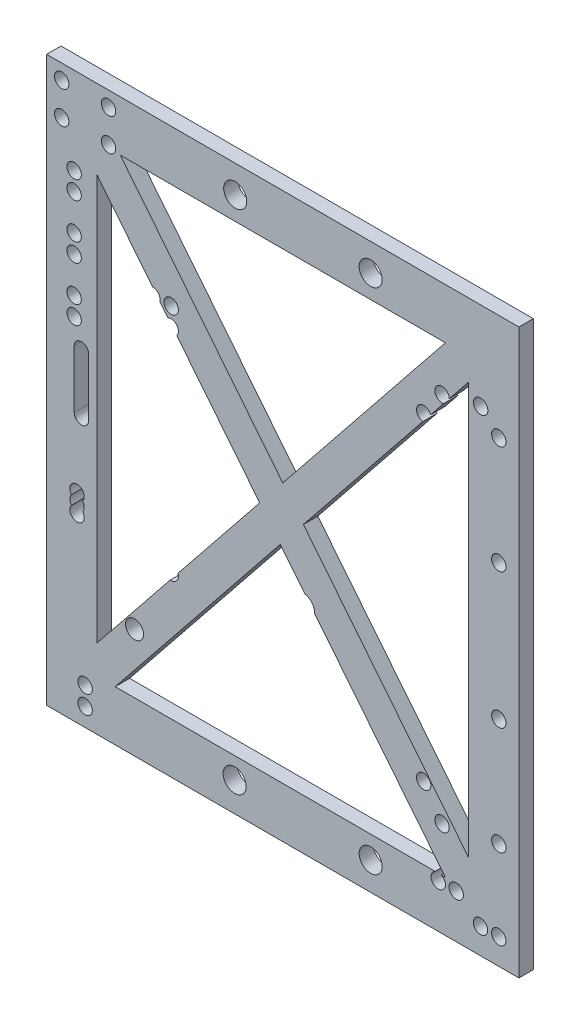
from build123d import *

# Parameters (mm, degrees)
SKETCH3_W            = 65.532
SKETCH3_H            = 78.232
SKETCH3_R            = 1
SKETCH3_R_2          = 1.25
SKETCH3_R_3          = 1.6
BOSS_EXTRUDE10_DEPTH = 2


with BuildPart() as part:
    # Sketch3 → Boss-Extrude10 (new body)
    with BuildSketch(Plane.XY):
        with Locations((-32.766, 39.116)):
            Rectangle(SKETCH3_W, SKETCH3_H)
        with Locations((-60.198, 2.535)):
            Circle(SKETCH3_R, mode=Mode.SUBTRACT)
        with Locations((-60.198, 5.075)):
            Circle(SKETCH3_R, mode=Mode.SUBTRACT)
        with Locations((-53.34, 15.24)):
            Circle(SKETCH3_R_2, mode=Mode.SUBTRACT)
        with Locations((-39.450944, 4.064)):
            Circle(SKETCH3_R_3, mode=Mode.SUBTRACT)
        with BuildLine():
            ThreePointArc((-60.547487864, 25.781), (-60.378588258, 25.483259443), (-60.32, 25.146))
            ThreePointArc((-60.32, 25.146), (-61.657259443, 24.204588258), (-62.092512136, 25.781))
            ThreePointArc((-62.092512136, 25.781), (-62.32, 26.416), (-62.092512136, 27.051))
            ThreePointArc((-62.092512136, 27.051), (-61.657259443, 28.627411742), (-60.32, 27.686))
            ThreePointArc((-60.32, 27.686), (-60.378588258, 27.348740557), (-60.547487864, 27.051))
            ThreePointArc((-60.547487864, 27.051), (-60.378588258, 26.753259443), (-60.32, 26.416))
            ThreePointArc((-60.32, 26.416), (-60.378588258, 26.078740557), (-60.547487864, 25.781))
        make_face(mode=Mode.SUBTRACT)
        with BuildLine():
            Line((-11.628420455, 7), (-56.019094707, 7))
            Line((-56.019094707, 7), (-33.112109743, 35.552384115))
            Line((-33.112109743, 35.552384115), (-29.697720228, 31.296522373))
            ThreePointArc((-29.697720228, 31.296522373), (-28.738744364, 30.752879791), (-28.359, 29.718))
            ThreePointArc((-28.359, 29.718), (-28.359594089, 29.67440261), (-28.361375915, 29.630837597))
            Line((-28.361375915, 29.630837597), (-10.205124779, 7))
            Line((-10.205124779, 7), (-10.773355545, 7))
            ThreePointArc((-10.773355545, 7), (-10.356041134, 6.631008199), (-10.200888, 6.096))
            ThreePointArc((-10.200888, 6.096), (-11.735896199, 5.251153134), (-11.628420455, 7))
        make_face(mode=Mode.SUBTRACT)
        with Locations((-20.574, 3.890944)):
            Circle(SKETCH3_R_3, mode=Mode.SUBTRACT)
        with Locations((-8.700888, 6.096)):
            Circle(SKETCH3_R, mode=Mode.SUBTRACT)
        with Locations((-5.339, 3.556)):
            Circle(SKETCH3_R, mode=Mode.SUBTRACT)
        with Locations((-2.799, 3.556)):
            Circle(SKETCH3_R, mode=Mode.SUBTRACT)
        with Locations((-10.668, 13.208)):
            Circle(SKETCH3_R, mode=Mode.SUBTRACT)
        with Locations((-13.213, 17.018)):
            Circle(SKETCH3_R, mode=Mode.SUBTRACT)
        with Locations((-2.794, 14.728)):
            Circle(SKETCH3_R, mode=Mode.SUBTRACT)
        with Locations((-2.794, 29.718)):
            Circle(SKETCH3_R, mode=Mode.SUBTRACT)
        with BuildLine():
            ThreePointArc((-61.706, 45.116), (-60.706, 46.116), (-59.706, 45.116))
            Line((-59.706, 45.116), (-59.706, 37.116))
            ThreePointArc((-59.706, 37.116), (-60.706, 36.116), (-61.706, 37.116))
            Line((-61.706, 37.116), (-61.706, 45.116))
        make_face(mode=Mode.SUBTRACT)
        with Locations((-61.722, 48.629)):
            Circle(SKETCH3_R, mode=Mode.SUBTRACT)
        with Locations((-61.722, 51.169)):
            Circle(SKETCH3_R, mode=Mode.SUBTRACT)
        with Locations((-61.722, 56.129)):
            Circle(SKETCH3_R, mode=Mode.SUBTRACT)
        with Locations((-61.722, 58.669)):
            Circle(SKETCH3_R, mode=Mode.SUBTRACT)
        with BuildLine():
            Line((-58.532, 10.995023961), (-58.532, 67.236976039))
            Line((-58.532, 67.236976039), (-50.821827001, 57.626640091))
            ThreePointArc((-50.821827001, 57.626640091), (-50.014999166, 57.252778474), (-49.824952048, 56.384086494))
            Line((-49.824952048, 56.384086494), (-48.700366603, 54.982348306))
            ThreePointArc((-48.700366603, 54.982348306), (-47.474999166, 54.712778474), (-47.477503777, 53.458112393))
            Line((-47.477503777, 53.458112393), (-35.971124779, 39.116))
            Line((-35.971124779, 39.116), (-47.320258494, 24.969885803))
            ThreePointArc((-47.320258494, 24.969885803), (-47.275179837, 24.801577784), (-47.26, 24.628))
            ThreePointArc((-47.26, 24.628), (-47.600460693, 23.876329925), (-48.390015804, 23.636488078))
            Line((-48.390015804, 23.636488078), (-58.532, 10.995023961))
        make_face(mode=Mode.SUBTRACT)
        with Locations((-48.255, 56.627)):
            Circle(SKETCH3_R, mode=Mode.SUBTRACT)
        Polygon((-32.766, 43.111023961), (-55.326875221, 71.232), (-10.205124779, 71.232), align=None, mode=Mode.SUBTRACT)
        with Locations((-61.722, 63.629)):
            Circle(SKETCH3_R, mode=Mode.SUBTRACT)
        with Locations((-61.722, 66.169)):
            Circle(SKETCH3_R, mode=Mode.SUBTRACT)
        with Locations((-63.448, 71.664)):
            Circle(SKETCH3_R, mode=Mode.SUBTRACT)
        with Locations((-63.448, 76.164)):
            Circle(SKETCH3_R, mode=Mode.SUBTRACT)
        with Locations((-56.948, 71.664)):
            Circle(SKETCH3_R, mode=Mode.SUBTRACT)
        with Locations((-56.948, 76.164)):
            Circle(SKETCH3_R, mode=Mode.SUBTRACT)
        with Locations((-39.37, 74.422)):
            Circle(SKETCH3_R_3, mode=Mode.SUBTRACT)
        with BuildLine():
            Line((-9.668009055, 64.774255485), (-7, 68.099792192))
            Line((-7, 68.099792192), (-7, 10.995023961))
            Line((-7, 10.995023961), (-29.906984964, 39.547408077))
            Line((-29.906984964, 39.547408077), (-13.321002101, 60.220986655))
            ThreePointArc((-13.321002101, 60.220986655), (-13.983000834, 61.839778474), (-12.259188179, 61.544483353))
            Line((-12.259188179, 61.544483353), (-10.455353631, 63.792870775))
            ThreePointArc((-10.455353631, 63.792870775), (-11.448000834, 65.395778474), (-9.668009055, 64.774255485))
        make_face(mode=Mode.SUBTRACT)
        with Locations((-2.794, 48.514)):
            Circle(SKETCH3_R, mode=Mode.SUBTRACT)
        with Locations((-20.574, 74.422)):
            Circle(SKETCH3_R_3, mode=Mode.SUBTRACT)
        with Locations((-2.794, 63.504)):
            Circle(SKETCH3_R, mode=Mode.SUBTRACT)
        with Locations((-5.309112, 66.04)):
            Circle(SKETCH3_R, mode=Mode.SUBTRACT)
    extrude(amount=BOSS_EXTRUDE10_DEPTH)


solid = part.part
